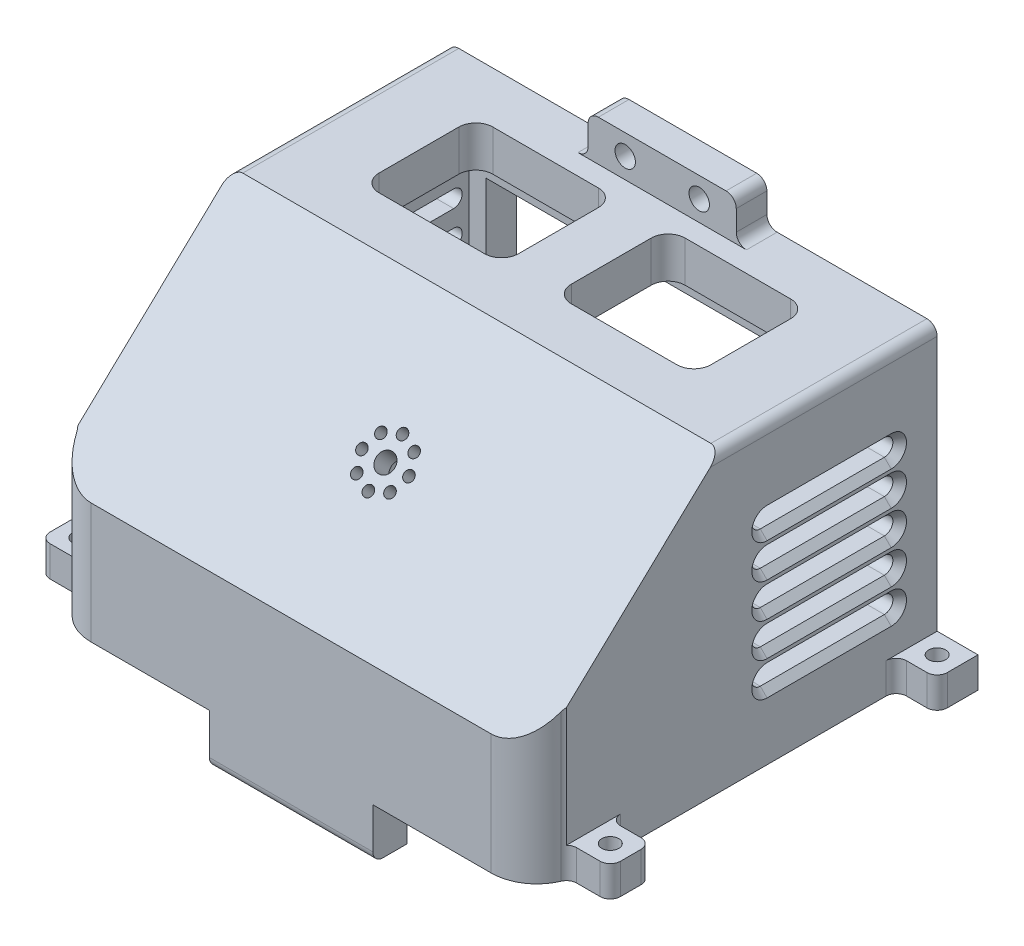
from build123d import *

# Parameters (mm, degrees)
SKETCH1_W           = 113.5
SKETCH1_H           = 9
SKETCH1_W_2         = 1.75
SKETCH1_H_2         = 30
BOSS_EXTRUDE1_DEPTH = 87
SKETCH2_R           = 2.5
BOSS_EXTRUDE2_DEPTH = 9
SKETCH3_W           = 113.5
SKETCH3_H           = 99
BOSS_EXTRUDE3_DEPTH = 12
BOSS_EXTRUDE4_DEPTH = 140
CUT_EXTRUDE1_DEPTH  = 144
SKETCH6_W           = 103.5
SKETCH6_H           = 37
CUT_EXTRUDE2_DEPTH  = 9
FILLET1_R           = 3
SKETCH7_W           = 43.5
SKETCH7_H           = 12
SKETCH7_R           = 3
BOSS_EXTRUDE5_DEPTH = 9
FILLET2_R           = 3
SKETCH8_R           = 2.75
SKETCH8_R_2         = 1.5
CUT_EXTRUDE3_DEPTH  = 9
SKETCH11_W          = 48
SKETCH11_H          = 10
BOSS_EXTRUDE6_DEPTH = 15
FILLET3_R           = 3
SKETCH12_W          = 97.5
SKETCH12_H          = 33.4458442
CUT_EXTRUDE4_DEPTH  = 12
FILLET4_R           = 5
SKETCH13_W          = 15.5
SKETCH13_H          = 12
BOSS_EXTRUDE7_DEPTH = 34
FILLET5_R           = 5
SKETCH14_R          = 2.5
CUT_EXTRUDE5_DEPTH  = 143.5
CHAMFER1_SIZE       = 2


with BuildPart() as part:
    # Sketch1 → Boss-Extrude1 (new body)
    with BuildSketch(Plane(origin=(0, 0, 0), x_dir=(1, 0, 0), z_dir=(0, 1, 0))):
        with BuildLine():
            Line((-56.816469529, -0.880909286), (-71.816469529, -0.880909286))
            Line((-71.816469529, -0.880909286), (-71.816469529, -15.880909286))
            Line((-71.816469529, -15.880909286), (-71.816469529, -93.880909286))
            Line((-71.816469529, -93.880909286), (-71.816469529, -109.772597687))
            ThreePointArc((-71.816469529, -109.772597687), (-71.459264851, -110.209785535), (-71.190293205, -110.706155005))
            ThreePointArc((-71.190293205, -110.706155005), (-66.237840412, -116.652413453), (-58.827132989, -118.880909286))
            Line((-58.827132989, -118.880909286), (-25.066469529, -118.880909286))
            Line((-25.066469529, -118.880909286), (24.933530471, -118.880909286))
            Line((24.933530471, -118.880909286), (58.694193931, -118.880909286))
            ThreePointArc((58.694193931, -118.880909286), (66.104901354, -116.652413453), (71.057354147, -110.706155005))
            ThreePointArc((71.057354147, -110.706155005), (71.326325793, -110.209785535), (71.683530471, -109.772597687))
            Line((71.683530471, -109.772597687), (71.683530471, -93.880909286))
            Line((71.683530471, -93.880909286), (71.683530471, -15.880909286))
            Line((71.683530471, -15.880909286), (71.683530471, -0.880909286))
            Line((71.683530471, -0.880909286), (56.683530471, -0.880909286))
            Line((56.683530471, -0.880909286), (56.683530471, -9.880909286))
            Line((56.683530471, -9.880909286), (56.683530471, -78.880909286))
            Line((56.683530471, -78.880909286), (58.433530471, -78.880909286))
            Line((58.433530471, -78.880909286), (58.433530471, -108.880909286))
            Line((58.433530471, -108.880909286), (56.683530471, -108.880909286))
            Line((56.683530471, -108.880909286), (24.933530471, -108.880909286))
            Line((24.933530471, -108.880909286), (-25.066469529, -108.880909286))
            Line((-25.066469529, -108.880909286), (-56.816469529, -108.880909286))
            Line((-56.816469529, -108.880909286), (-58.566469529, -108.880909286))
            Line((-58.566469529, -108.880909286), (-58.566469529, -78.880909286))
            Line((-58.566469529, -78.880909286), (-56.816469529, -78.880909286))
            Line((-56.816469529, -78.880909286), (-56.816469529, -9.880909286))
            Line((-56.816469529, -9.880909286), (-56.816469529, -0.880909286))
        make_face()
        with Locations((-0.066469529, -5.380909286)):
            Rectangle(SKETCH1_W, SKETCH1_H)
        with Locations((57.558530471, -93.880909286)):
            Rectangle(SKETCH1_W_2, SKETCH1_H_2)
        with Locations((-57.691469529, -93.880909286)):
            Rectangle(SKETCH1_W_2, SKETCH1_H_2)
    extrude(amount=BOSS_EXTRUDE1_DEPTH)

    # Sketch2 → Boss-Extrude2 (add)
    # profile 1 of 4: a face of its own
    with BuildSketch(Plane.XZ):
        with BuildLine():
            ThreePointArc((73.81778027, 108.880909286), (72.661262824, 109.112793067), (71.683530471, 109.772597687))
            Line((71.683530471, 109.772597687), (71.683530471, 93.880909286))
            ThreePointArc((71.683530471, 93.880909286), (72.562210127, 96.002229629), (74.683530471, 96.880909286))
            Line((74.683530471, 96.880909286), (80.683530471, 96.880909286))
            ThreePointArc((80.683530471, 96.880909286), (82.804850815, 97.759588942), (83.683530471, 99.880909286))
            Line((83.683530471, 99.880909286), (83.683530471, 105.880909286))
            ThreePointArc((83.683530471, 105.880909286), (82.804850815, 108.002229629), (80.683530471, 108.880909286))
            Line((80.683530471, 108.880909286), (73.81778027, 108.880909286))
        make_face()
        with Locations(Location((77.683530471, 102.880909286, 0), (0, 0, 270))):
            Circle(SKETCH2_R, mode=Mode.SUBTRACT)
    # profile 2 of 4: a face of its own
    with BuildSketch(Plane.XZ):
        with BuildLine():
            ThreePointArc((74.683530471, 12.880909286), (72.562210127, 13.759588942), (71.683530471, 15.880909286))
            Line((71.683530471, 15.880909286), (71.683530471, 0.880909286))
            Line((71.683530471, 0.880909286), (83.683530471, 0.880909286))
            Line((83.683530471, 0.880909286), (83.683530471, 9.880909286))
            ThreePointArc((83.683530471, 9.880909286), (82.804850815, 12.002229629), (80.683530471, 12.880909286))
            Line((80.683530471, 12.880909286), (74.683530471, 12.880909286))
        make_face()
        with Locations(Location((77.683530471, 6.880909286, 0), (0, 0, 270))):
            Circle(SKETCH2_R, mode=Mode.SUBTRACT)
    # profile 3 of 4: a face of its own
    with BuildSketch(Plane.XZ):
        with BuildLine():
            Line((-71.816469529, 0.880909286), (-71.816469529, 15.880909286))
            ThreePointArc((-71.816469529, 15.880909286), (-72.695149185, 13.759588942), (-74.816469529, 12.880909286))
            Line((-74.816469529, 12.880909286), (-80.816469529, 12.880909286))
            ThreePointArc((-80.816469529, 12.880909286), (-82.937789873, 12.002229629), (-83.816469529, 9.880909286))
            Line((-83.816469529, 9.880909286), (-83.816469529, 0.880909286))
            Line((-83.816469529, 0.880909286), (-71.816469529, 0.880909286))
        make_face()
        with Locations(Location((-77.816469529, 6.880909286, 0), (0, 0, 270))):
            Circle(SKETCH2_R, mode=Mode.SUBTRACT)
    # profile 4 of 4: a face of its own
    with BuildSketch(Plane.XZ):
        with BuildLine():
            Line((-71.816469529, 93.880909286), (-71.816469529, 109.772597687))
            ThreePointArc((-71.816469529, 109.772597687), (-72.794201882, 109.112793067), (-73.950719328, 108.880909286))
            Line((-73.950719328, 108.880909286), (-80.816469529, 108.880909286))
            ThreePointArc((-80.816469529, 108.880909286), (-82.937789873, 108.002229629), (-83.816469529, 105.880909286))
            Line((-83.816469529, 105.880909286), (-83.816469529, 99.880909286))
            ThreePointArc((-83.816469529, 99.880909286), (-82.937789873, 97.759588942), (-80.816469529, 96.880909286))
            Line((-80.816469529, 96.880909286), (-74.816469529, 96.880909286))
            ThreePointArc((-74.816469529, 96.880909286), (-72.695149185, 96.002229629), (-71.816469529, 93.880909286))
        make_face()
        with Locations(Location((-77.816469529, 102.880909286, 0), (0, 0, 270))):
            Circle(SKETCH2_R, mode=Mode.SUBTRACT)
    extrude(amount=-BOSS_EXTRUDE2_DEPTH)

    # Sketch3 → Boss-Extrude3 (add)
    with BuildSketch(Plane(origin=(0, 87, 0), x_dir=(1, 0, 0), z_dir=(0, 1, 0))):
        with Locations((-0.066469529, -59.380909286)):
            Rectangle(SKETCH3_W, SKETCH3_H)
    extrude(amount=-BOSS_EXTRUDE3_DEPTH)

    # Sketch4 → Boss-Extrude4 (add)
    with BuildSketch(Plane.ZY.offset(71.816469529)):
        Polygon((64.326753486, 87), (55.326753486, 87), (109.772597687, 35), (109.772597687, 44), align=None)
    extrude(amount=-BOSS_EXTRUDE4_DEPTH)

    # Sketch5 → Cut-Extrude1 (cut)
    with BuildSketch(Plane(origin=(71.683530471, 0, 0), x_dir=(0, 0, -1), z_dir=(1, 0, 0))):
        Polygon((-64.326753486, 87), (-118.880909286, 35.381887483), (-118.880909286, 87), (-109.772597687, 87), align=None)
    extrude(amount=-CUT_EXTRUDE1_DEPTH, mode=Mode.SUBTRACT)

    # Sketch6 → Cut-Extrude2 (cut)
    with BuildSketch(Plane(origin=(0, 0, 0.880909286), x_dir=(-1, 0, 0), z_dir=(0, 0, -1))):
        with Locations((0.066469529, 48.5)):
            Rectangle(SKETCH6_W, SKETCH6_H)
    extrude(amount=-CUT_EXTRUDE2_DEPTH, mode=Mode.SUBTRACT)

    # Fillet1
    fillet1_edges = [part.edges().sort_by_distance(p)[0] for p in [
        (-71.816469529, 87, 32.603831386),
        (71.683530471, 87, 32.603831386),
    ]]
    fillet(fillet1_edges, radius=FILLET1_R)

    # Sketch7 → Boss-Extrude5 (add)
    with BuildSketch(Plane(origin=(0, 0, 0.880909286), x_dir=(-1, 0, 0), z_dir=(0, 0, -1))):
        with Locations((0.066469529, 93)):
            Rectangle(SKETCH7_W, SKETCH7_H)
        with Locations((-10.803530471, 93)):
            Circle(SKETCH7_R, mode=Mode.SUBTRACT)
        with Locations((10.936469529, 93)):
            Circle(SKETCH7_R, mode=Mode.SUBTRACT)
    extrude(amount=-BOSS_EXTRUDE5_DEPTH)

    # Fillet2
    fillet2_edges = [part.edges().sort_by_distance(p)[0] for p in [
        (-21.816469529, 99, 5.380909286),
        (-21.816469529, 87, 5.380909286),
        (21.683530471, 87, 5.380909286),
        (21.683530471, 99, 5.380909286),
    ]]
    fillet(fillet2_edges, radius=FILLET2_R)

    # Sketch8 → Cut-Extrude3 (cut)
    with BuildSketch(Plane(origin=(0, 78.018245375, 73.819391192), x_dir=(1, 0, 0), z_dir=(-1.271741980831244e-15, 0.7263831279634976, 0.6872900053179626))):
        with Locations(Location((0.16332034, -24.199331713, 0), (0, 0, 270))):
            Circle(SKETCH8_R)
        with Locations(Location((7.06832034, -24.199331713, 0), (0, 0, 270))):
            Circle(SKETCH8_R_2)
        with Locations(Location((5.045892664, -29.081904037, 0), (0, 0, 270))):
            Circle(SKETCH8_R_2)
        with Locations(Location((0.16332034, -31.104331713, 0), (0, 0, 270))):
            Circle(SKETCH8_R_2)
        with Locations(Location((-4.719251984, -29.081904037, 0), (0, 0, 270))):
            Circle(SKETCH8_R_2)
        with Locations(Location((-6.74167966, -24.199331713, 0), (0, 0, 270))):
            Circle(SKETCH8_R_2)
        with Locations(Location((-4.719251984, -19.316759389, 0), (0, 0, 270))):
            Circle(SKETCH8_R_2)
        with Locations(Location((0.16332034, -17.294331713, 0), (0, 0, 270))):
            Circle(SKETCH8_R_2)
        with Locations(Location((5.045892664, -19.316759389, 0), (0, 0, 270))):
            Circle(SKETCH8_R_2)
    extrude(amount=-CUT_EXTRUDE3_DEPTH, mode=Mode.SUBTRACT)

    # Sketch11 → Boss-Extrude6 (add)
    with BuildSketch(Plane.XZ):
        with Locations((-0.066469529, 113.880909286)):
            Rectangle(SKETCH11_W, SKETCH11_H)
    extrude(amount=BOSS_EXTRUDE6_DEPTH)

    # Fillet3
    fillet3_edges = [part.edges().sort_by_distance(p)[0] for p in [
        (-0.066469529, -15, 118.880909286),
    ]]
    fillet(fillet3_edges, radius=FILLET3_R)

    # Sketch12 → Cut-Extrude4 (cut)
    with BuildSketch(Plane(origin=(0, 87, 0), x_dir=(1, 0, 0), z_dir=(0, 1, 0))):
        with Locations((-0.066469529, -32.603831386)):
            Rectangle(SKETCH12_W, SKETCH12_H)
    extrude(amount=-CUT_EXTRUDE4_DEPTH, mode=Mode.SUBTRACT)

    # Fillet4
    fillet4_edges = [part.edges().sort_by_distance(p)[0] for p in [
        (48.683530471, 81, 15.880909286),
        (48.683530471, 81, 49.326753486),
        (-48.816469529, 81, 49.326753486),
        (-48.816469529, 81, 15.880909286),
    ]]
    fillet(fillet4_edges, radius=FILLET4_R)

    # Sketch13 → Boss-Extrude7 (add)
    with BuildSketch(Plane.XY.offset(15.880909286)):
        with Locations((-0.066469529, 81)):
            Rectangle(SKETCH13_W, SKETCH13_H)
    extrude(amount=BOSS_EXTRUDE7_DEPTH)

    # Fillet5
    fillet5_edges = [part.edges().sort_by_distance(p)[0] for p in [
        (-7.816469529, 81, 49.326753486),
        (-7.816469529, 81, 15.880909286),
        (7.683530471, 81, 49.326753486),
        (7.683530471, 81, 15.880909286),
    ]]
    fillet(fillet5_edges, radius=FILLET5_R)

    # Sketch14 → Cut-Extrude5 (cut)
    with BuildSketch(Plane.ZY.offset(71.816469529)):
        with Locations((14.380909286, 21.5)):
            Circle(SKETCH14_R)
        with BuildLine():
            Line((14.380909286, 19), (50.826753486, 19))
            ThreePointArc((50.826753486, 19), (48.326753486, 21.5), (50.826753486, 24))
            Line((50.826753486, 24), (14.380909286, 24))
            ThreePointArc((14.380909286, 24), (16.148676239, 23.267766953), (16.880909286, 21.5))
            ThreePointArc((16.880909286, 21.5), (16.148676239, 19.732233047), (14.380909286, 19))
        make_face()
        with Locations((50.826753486, 21.5)):
            Circle(SKETCH14_R)
        with Locations((14.380909286, 31.5)):
            Circle(SKETCH14_R)
        with BuildLine():
            Line((14.380909286, 29), (50.826753486, 29))
            ThreePointArc((50.826753486, 29), (48.326753486, 31.5), (50.826753486, 34))
            Line((50.826753486, 34), (14.380909286, 34))
            ThreePointArc((14.380909286, 34), (16.148676239, 33.267766953), (16.880909286, 31.5))
            ThreePointArc((16.880909286, 31.5), (16.148676239, 29.732233047), (14.380909286, 29))
        make_face()
        with Locations((50.826753486, 31.5)):
            Circle(SKETCH14_R)
        with Locations((14.380909286, 41.5)):
            Circle(SKETCH14_R)
        with BuildLine():
            Line((14.380909286, 39), (50.826753486, 39))
            ThreePointArc((50.826753486, 39), (48.326753486, 41.5), (50.826753486, 44))
            Line((50.826753486, 44), (14.380909286, 44))
            ThreePointArc((14.380909286, 44), (16.148676239, 43.267766953), (16.880909286, 41.5))
            ThreePointArc((16.880909286, 41.5), (16.148676239, 39.732233047), (14.380909286, 39))
        make_face()
        with Locations((50.826753486, 41.5)):
            Circle(SKETCH14_R)
        with Locations((14.380909286, 51.5)):
            Circle(SKETCH14_R)
        with BuildLine():
            Line((14.380909286, 49), (50.826753486, 49))
            ThreePointArc((50.826753486, 49), (48.326753486, 51.5), (50.826753486, 54))
            Line((50.826753486, 54), (14.380909286, 54))
            ThreePointArc((14.380909286, 54), (16.148676239, 53.267766953), (16.880909286, 51.5))
            ThreePointArc((16.880909286, 51.5), (16.148676239, 49.732233047), (14.380909286, 49))
        make_face()
        with Locations((50.826753486, 51.5)):
            Circle(SKETCH14_R)
        with Locations((14.380909286, 61.5)):
            Circle(SKETCH14_R)
        with BuildLine():
            Line((50.826753486, 64), (14.380909286, 64))
            ThreePointArc((14.380909286, 64), (16.148676239, 63.267766953), (16.880909286, 61.5))
            ThreePointArc((16.880909286, 61.5), (16.148676239, 59.732233047), (14.380909286, 59))
            Line((14.380909286, 59), (50.826753486, 59))
            ThreePointArc((50.826753486, 59), (48.326753486, 61.5), (50.826753486, 64))
        make_face()
        with Locations((50.826753486, 61.5)):
            Circle(SKETCH14_R)
    extrude(amount=-CUT_EXTRUDE5_DEPTH, mode=Mode.SUBTRACT)

    # Chamfer1
    chamfer1_edges = [part.edges().sort_by_distance(p)[0] for p in [
        (-71.816469529, 41.5, 53.326753486),
        (71.683530471, 51.5, 11.880909286),
        (-71.816469529, 54, 32.603831386),
        (71.683530471, 51.5, 53.326753486),
        (-71.816469529, 49, 32.603831386),
        (71.683530471, 54, 32.603831386),
        (71.683530471, 49, 32.603831386),
        (-71.816469529, 51.5, 11.880909286),
        (-71.816469529, 51.5, 53.326753486),
        (71.683530471, 61.5, 11.880909286),
        (-71.816469529, 64, 32.603831386),
        (71.683530471, 61.5, 53.326753486),
        (-71.816469529, 59, 32.603831386),
        (71.683530471, 64, 32.603831386),
        (71.683530471, 59, 32.603831386),
        (-71.816469529, 61.5, 11.880909286),
        (-71.816469529, 61.5, 53.326753486),
        (71.683530471, 21.5, 11.880909286),
        (-71.816469529, 24, 32.603831386),
        (71.683530471, 21.5, 53.326753486),
        (-71.816469529, 19, 32.603831386),
        (71.683530471, 24, 32.603831386),
        (71.683530471, 19, 32.603831386),
        (-71.816469529, 21.5, 11.880909286),
        (-71.816469529, 21.5, 53.326753486),
        (71.683530471, 31.5, 11.880909286),
        (-71.816469529, 34, 32.603831386),
        (71.683530471, 31.5, 53.326753486),
        (-71.816469529, 29, 32.603831386),
        (71.683530471, 34, 32.603831386),
        (71.683530471, 29, 32.603831386),
        (-71.816469529, 31.5, 11.880909286),
        (-71.816469529, 31.5, 53.326753486),
        (71.683530471, 41.5, 11.880909286),
        (-71.816469529, 44, 32.603831386),
        (71.683530471, 41.5, 53.326753486),
        (-71.816469529, 39, 32.603831386),
        (71.683530471, 44, 32.603831386),
        (71.683530471, 39, 32.603831386),
        (-71.816469529, 41.5, 11.880909286),
    ]]
    chamfer(chamfer1_edges, length=CHAMFER1_SIZE)


solid = part.part
